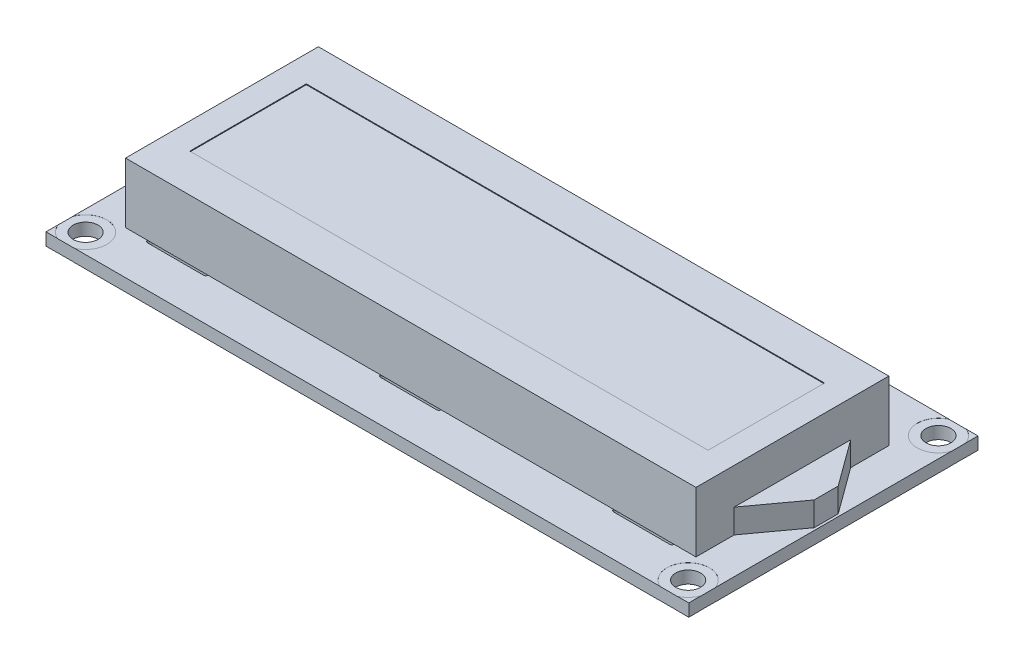
from build123d import *

# Parameters (mm, degrees)
SKETCH1_W             = 80
SKETCH1_H             = 36
PCB_DEPTH             = 1.55
SKETCH2_R             = 1.55
MOUNTINGHOLES_DEPTH   = 44.890801998
SKETCH3_R             = 2.65
PADS_DEPTH            = 0.01
SKETCH4_R             = 0.5
CONNECTERHOLES_DEPTH  = 44.890801998
SKETCH5_W             = 71
SKETCH5_H             = 24
PANELBODY_DEPTH       = 7.5
SKETCH6_W             = 64.5
SKETCH6_H             = 14.5
SCREEN_DEPTH          = 0.1
PANELMOUNTHOLES_DEPTH = 45.5
PANELMOUNTS_DEPTH     = 2.5
WHITETHING_DEPTH      = 3


with BuildPart() as part:
    # Sketch1 → PCB (new body)
    with BuildSketch(Plane(origin=(0, 0, 0), x_dir=(1, 0, 0), z_dir=(0, 1, 0))):
        Rectangle(SKETCH1_W, SKETCH1_H)
    extrude(amount=PCB_DEPTH)

    # Sketch2 → MountingHoles (cut, through all)
    with BuildSketch(Plane(origin=(0, 1.55, 0), x_dir=(1, 0, 0), z_dir=(0, 1, 0))):
        with Locations(Location((-37.5, 15.575, 0), (0, 0, 270))):
            Circle(SKETCH2_R)
        with Locations(Location((37.5, 15.575, 0), (0, 0, 270))):
            Circle(SKETCH2_R)
        with Locations(Location((37.5, -15.575, 0), (0, 0, 270))):
            Circle(SKETCH2_R)
        with Locations(Location((-37.5, -15.575, 0), (0, 0, 270))):
            Circle(SKETCH2_R)
    extrude(amount=-MOUNTINGHOLES_DEPTH, mode=Mode.SUBTRACT)

    # Sketch3 → Pads (cut)
    with BuildSketch(Plane(origin=(0, 1.55, 0), x_dir=(1, 0, 0), z_dir=(0, 1, 0))):
        with Locations((-37.5, 15.575)):
            Circle(SKETCH3_R)
        with Locations((37.5, 15.575)):
            Circle(SKETCH3_R)
        with Locations((37.5, -15.575)):
            Circle(SKETCH3_R)
        with Locations((-37.5, -15.575)):
            Circle(SKETCH3_R)
        with BuildLine():
            Line((-32.9, 18), (-31.1, 18))
            Line((-31.1, 18), (-31.1, 16))
            ThreePointArc((-31.1, 16), (-32, 15.1), (-32.9, 16))
            Line((-32.9, 16), (-32.9, 18))
        make_face()
        with BuildLine():
            Line((-30.36, 18), (-30.36, 16))
            ThreePointArc((-30.36, 16), (-29.46, 15.1), (-28.56, 16))
            Line((-28.56, 16), (-28.56, 18))
            Line((-28.56, 18), (-30.36, 18))
        make_face()
        with BuildLine():
            Line((-27.82, 18), (-27.82, 16))
            ThreePointArc((-27.82, 16), (-26.92, 15.1), (-26.02, 16))
            Line((-26.02, 16), (-26.02, 18))
            Line((-26.02, 18), (-27.82, 18))
        make_face()
        with BuildLine():
            Line((-25.28, 18), (-25.28, 16))
            ThreePointArc((-25.28, 16), (-24.38, 15.1), (-23.48, 16))
            Line((-23.48, 16), (-23.48, 18))
            Line((-23.48, 18), (-25.28, 18))
        make_face()
        with BuildLine():
            Line((-22.74, 18), (-22.74, 16))
            ThreePointArc((-22.74, 16), (-21.84, 15.1), (-20.94, 16))
            Line((-20.94, 16), (-20.94, 18))
            Line((-20.94, 18), (-22.74, 18))
        make_face()
        with BuildLine():
            Line((-20.2, 18), (-20.2, 16))
            ThreePointArc((-20.2, 16), (-19.3, 15.1), (-18.4, 16))
            Line((-18.4, 16), (-18.4, 18))
            Line((-18.4, 18), (-20.2, 18))
        make_face()
        with BuildLine():
            Line((-17.66, 18), (-17.66, 16))
            ThreePointArc((-17.66, 16), (-16.76, 15.1), (-15.86, 16))
            Line((-15.86, 16), (-15.86, 18))
            Line((-15.86, 18), (-17.66, 18))
        make_face()
        with BuildLine():
            Line((-15.12, 18), (-15.12, 16))
            ThreePointArc((-15.12, 16), (-14.22, 15.1), (-13.32, 16))
            Line((-13.32, 16), (-13.32, 18))
            Line((-13.32, 18), (-15.12, 18))
        make_face()
        with BuildLine():
            Line((-12.58, 18), (-12.58, 16))
            ThreePointArc((-12.58, 16), (-11.68, 15.1), (-10.78, 16))
            Line((-10.78, 16), (-10.78, 18))
            Line((-10.78, 18), (-12.58, 18))
        make_face()
        with BuildLine():
            Line((-10.04, 18), (-10.04, 16))
            ThreePointArc((-10.04, 16), (-9.14, 15.1), (-8.24, 16))
            Line((-8.24, 16), (-8.24, 18))
            Line((-8.24, 18), (-10.04, 18))
        make_face()
        with BuildLine():
            Line((-7.5, 18), (-7.5, 16))
            ThreePointArc((-7.5, 16), (-6.6, 15.1), (-5.7, 16))
            Line((-5.7, 16), (-5.7, 18))
            Line((-5.7, 18), (-7.5, 18))
        make_face()
        with BuildLine():
            Line((-4.96, 18), (-4.96, 16))
            ThreePointArc((-4.96, 16), (-4.06, 15.1), (-3.16, 16))
            Line((-3.16, 16), (-3.16, 18))
            Line((-3.16, 18), (-4.96, 18))
        make_face()
        with BuildLine():
            Line((-2.42, 18), (-2.42, 16))
            ThreePointArc((-2.42, 16), (-1.52, 15.1), (-0.62, 16))
            Line((-0.62, 16), (-0.62, 18))
            Line((-0.62, 18), (-2.42, 18))
        make_face()
        with BuildLine():
            Line((0.12, 18), (0.12, 16))
            ThreePointArc((0.12, 16), (1.02, 15.1), (1.92, 16))
            Line((1.92, 16), (1.92, 18))
            Line((1.92, 18), (0.12, 18))
        make_face()
        with BuildLine():
            Line((2.66, 18), (2.66, 16))
            ThreePointArc((2.66, 16), (3.56, 15.1), (4.46, 16))
            Line((4.46, 16), (4.46, 18))
            Line((4.46, 18), (2.66, 18))
        make_face()
        with BuildLine():
            Line((5.2, 18), (5.2, 16))
            ThreePointArc((5.2, 16), (6.1, 15.1), (7, 16))
            Line((7, 16), (7, 18))
            Line((7, 18), (5.2, 18))
        make_face()
    pads = extrude(amount=-PADS_DEPTH, mode=Mode.SUBTRACT)

    # Sketch4 → ConnecterHoles (cut, through all)
    with BuildSketch(Plane(origin=(0, 1.55, 0), x_dir=(1, 0, 0), z_dir=(0, 1, 0))):
        with Locations(Location((-32, 16, 0), (0, 0, 270))):
            Circle(SKETCH4_R)
        with Locations(Location((-29.46, 16, 0), (0, 0, 270))):
            Circle(SKETCH4_R)
        with Locations(Location((-26.92, 16, 0), (0, 0, 270))):
            Circle(SKETCH4_R)
        with Locations(Location((-24.38, 16, 0), (0, 0, 270))):
            Circle(SKETCH4_R)
        with Locations(Location((-21.84, 16, 0), (0, 0, 270))):
            Circle(SKETCH4_R)
        with Locations(Location((-19.3, 16, 0), (0, 0, 270))):
            Circle(SKETCH4_R)
        with Locations(Location((-16.76, 16, 0), (0, 0, 270))):
            Circle(SKETCH4_R)
        with Locations(Location((-14.22, 16, 0), (0, 0, 270))):
            Circle(SKETCH4_R)
        with Locations(Location((-11.68, 16, 0), (0, 0, 270))):
            Circle(SKETCH4_R)
        with Locations(Location((-9.14, 16, 0), (0, 0, 270))):
            Circle(SKETCH4_R)
        with Locations(Location((-6.6, 16, 0), (0, 0, 270))):
            Circle(SKETCH4_R)
        with Locations(Location((-4.06, 16, 0), (0, 0, 270))):
            Circle(SKETCH4_R)
        with Locations(Location((-1.52, 16, 0), (0, 0, 270))):
            Circle(SKETCH4_R)
        with Locations(Location((1.02, 16, 0), (0, 0, 270))):
            Circle(SKETCH4_R)
        with Locations(Location((3.56, 16, 0), (0, 0, 270))):
            Circle(SKETCH4_R)
        with Locations(Location((6.1, 16, 0), (0, 0, 270))):
            Circle(SKETCH4_R)
    extrude(amount=-CONNECTERHOLES_DEPTH, mode=Mode.SUBTRACT)

    # Sketch5 → PanelBody (add)
    with BuildSketch(Plane(origin=(0, 1.55, 0), x_dir=(1, 0, 0), z_dir=(0, 1, 0))):
        with Locations((0, -0.6)):
            Rectangle(SKETCH5_W, SKETCH5_H)
    extrude(amount=PANELBODY_DEPTH)

    # Sketch6 → Screen (cut)
    with BuildSketch(Plane(origin=(0, 9.05, 0), x_dir=(1, 0, 0), z_dir=(0, 1, 0))):
        with Locations((0, -0.6)):
            Rectangle(SKETCH6_W, SKETCH6_H)
    extrude(amount=-SCREEN_DEPTH, mode=Mode.SUBTRACT)

    # Sketch7 → PanelMountHoles (cut, through all)
    with BuildSketch(Plane(origin=(0, 1.55, 0), x_dir=(1, 0, 0), z_dir=(0, 1, 0))):
        with BuildLine():
            Line((32.5, 11.125773197), (25.5, 11.125773197))
            ThreePointArc((25.5, 11.125773197), (25.225773197, 11.4), (25.5, 11.674226803))
            Line((25.5, 11.674226803), (32.5, 11.674226803))
            ThreePointArc((32.5, 11.674226803), (32.774226803, 11.4), (32.5, 11.125773197))
        make_face()
        with BuildLine():
            Line((-32.5, 11.125773197), (-25.5, 11.125773197))
            ThreePointArc((-25.5, 11.125773197), (-25.225773197, 11.4), (-25.5, 11.674226803))
            Line((-25.5, 11.674226803), (-32.5, 11.674226803))
            ThreePointArc((-32.5, 11.674226803), (-32.774226803, 11.4), (-32.5, 11.125773197))
        make_face()
        with BuildLine():
            Line((3.5, 11.125773197), (-3.5, 11.125773197))
            ThreePointArc((-3.5, 11.125773197), (-3.774226803, 11.4), (-3.5, 11.674226803))
            Line((-3.5, 11.674226803), (3.5, 11.674226803))
            ThreePointArc((3.5, 11.674226803), (3.774226803, 11.4), (3.5, 11.125773197))
        make_face()
        with BuildLine():
            Line((32.5, -12.325773197), (25.5, -12.325773197))
            ThreePointArc((25.5, -12.325773197), (25.225773197, -12.6), (25.5, -12.874226803))
            Line((25.5, -12.874226803), (32.5, -12.874226803))
            ThreePointArc((32.5, -12.874226803), (32.774226803, -12.6), (32.5, -12.325773197))
        make_face()
        with BuildLine():
            Line((-32.5, -12.325773197), (-25.5, -12.325773197))
            ThreePointArc((-25.5, -12.325773197), (-25.225773197, -12.6), (-25.5, -12.874226803))
            Line((-25.5, -12.874226803), (-32.5, -12.874226803))
            ThreePointArc((-32.5, -12.874226803), (-32.774226803, -12.6), (-32.5, -12.325773197))
        make_face()
        with BuildLine():
            Line((3.5, -12.325773197), (-3.5, -12.325773197))
            ThreePointArc((-3.5, -12.325773197), (-3.774226803, -12.6), (-3.5, -12.874226803))
            Line((-3.5, -12.874226803), (3.5, -12.874226803))
            ThreePointArc((3.5, -12.874226803), (3.774226803, -12.6), (3.5, -12.325773197))
        make_face()
    extrude(amount=-PANELMOUNTHOLES_DEPTH, mode=Mode.SUBTRACT)

    # Sketch8 → PanelMounts (add)
    with BuildSketch(Plane.XZ):
        Polygon((32.5, 12.325773197), (26.112848002, 9.29922858), (26.020796936, 9.493491089), (32.407948934, 12.520035706), align=None)
        Polygon((32.088339737, -8.338570324), (25.701187739, -11.365114941), (25.609136673, -11.170852432), (31.996288671, -8.144307815), align=None)
        Polygon((3.5, 12.325773197), (-2.887151998, 9.29922858), (-2.979203064, 9.493491089), (3.407948934, 12.520035706), align=None)
        Polygon((3.088339737, -8.338570324), (-3.298812261, -11.365114941), (-3.390863327, -11.170852432), (2.996288671, -8.144307815), align=None)
        Polygon((-25.5, 12.325773197), (-31.887151998, 9.29922858), (-31.979203064, 9.493491089), (-25.592051066, 12.520035706), align=None)
        Polygon((-25.911660263, -8.338570324), (-32.298812261, -11.365114941), (-32.390863327, -11.170852432), (-26.003711329, -8.144307815), align=None)
    extrude(amount=PANELMOUNTS_DEPTH)

    # Sketch9 → WhiteThing (add)
    with BuildSketch(Plane(origin=(0, 1.55, 0), x_dir=(1, 0, 0), z_dir=(0, 1, 0))):
        Polygon((35.5, -7.85), (35.5, 6.65), (39.7, 0.9), (39.7, -2.1), align=None)
    extrude(amount=WHITETHING_DEPTH)

    # BackSidePads: Pads across plane
    add(pads.mirror(Plane.ZX.offset(0.775)), mode=Mode.SUBTRACT)


solid = part.part
